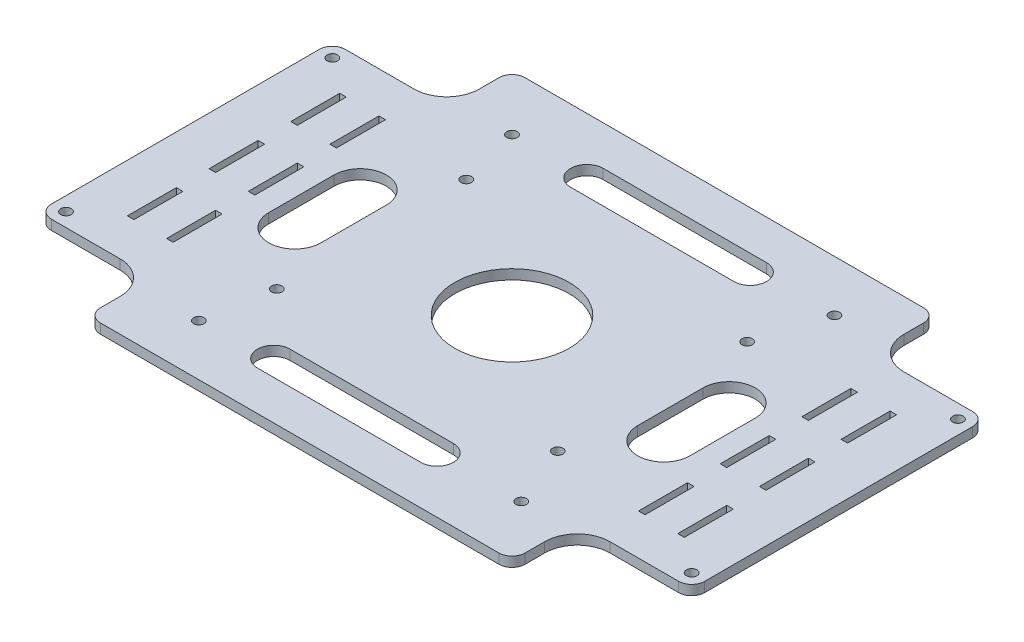
from build123d import *

# Parameters (mm, degrees)
SKETCH_1_R      = 1.6
SKETCH_1_R_2    = 17.5
SKETCH_1_W      = 2
SKETCH_1_H      = 15
EXTRUDE_1_DEPTH = 3
FILLET_2_R      = 4


with BuildPart() as part:
    # 草图1 → 凸台-拉伸1 (new body)
    with BuildSketch(Plane(origin=(0, 0, 0), x_dir=(1, 0, 0), z_dir=(0, 1, 0))):
        with BuildLine():
            Line((-65, 65), (65, 65))
            Line((65, 65), (65, 55))
            ThreePointArc((65, 55), (67.928932188, 47.928932188), (75, 45))
            Line((75, 45), (100, 45))
            Line((100, 45), (100, -45))
            Line((100, -45), (75, -45))
            ThreePointArc((75, -45), (67.928932188, -47.928932188), (65, -55))
            Line((65, -55), (65, -65))
            Line((65, -65), (-65, -65))
            Line((-65, -65), (-65, -55))
            ThreePointArc((-65, -55), (-67.928932188, -47.928932188), (-75, -45))
            Line((-75, -45), (-100, -45))
            Line((-100, -45), (-100, 45))
            Line((-100, 45), (-75, 45))
            ThreePointArc((-75, 45), (-67.928932188, 47.928932188), (-65, 55))
            Line((-65, 55), (-65, 65))
        make_face()
        with Locations(Location((-47.93, 47.93, 0), (0, 0, 270))):
            Circle(SKETCH_1_R, mode=Mode.SUBTRACT)
        with Locations(Location((49.344213562, 49.344213562, 0), (0, 0, 270))):
            Circle(SKETCH_1_R, mode=Mode.SUBTRACT)
        with Locations(Location((50.758427125, -47.93, 0), (0, 0, 270))):
            Circle(SKETCH_1_R, mode=Mode.SUBTRACT)
        with Locations(Location((-46.515786438, -49.344213562, 0), (0, 0, 270))):
            Circle(SKETCH_1_R, mode=Mode.SUBTRACT)
        with Locations(Location((43, -29, 0), (0, 0, 270))):
            Circle(SKETCH_1_R, mode=Mode.SUBTRACT)
        with Locations(Location((-43, -29, 0), (0, 0, 270))):
            Circle(SKETCH_1_R, mode=Mode.SUBTRACT)
        with Locations(Location((-43, 29, 0), (0, 0, 270))):
            Circle(SKETCH_1_R, mode=Mode.SUBTRACT)
        with Locations(Location((43, 29, 0), (0, 0, 270))):
            Circle(SKETCH_1_R, mode=Mode.SUBTRACT)
        with Locations(Location((0, 0, 0), (0, 0, 270))):
            Circle(SKETCH_1_R_2, mode=Mode.SUBTRACT)
        with Locations(Location((-95.757359313, 40.757359313, 0), (0, 0, 270))):
            Circle(SKETCH_1_R, mode=Mode.SUBTRACT)
        with Locations(Location((95.757359313, 40.757359313, 0), (0, 0, 270))):
            Circle(SKETCH_1_R, mode=Mode.SUBTRACT)
        with Locations(Location((95.757359313, -40.757359313, 0), (0, 0, 270))):
            Circle(SKETCH_1_R, mode=Mode.SUBTRACT)
        with Locations(Location((-95.757359313, -40.757359313, 0), (0, 0, 270))):
            Circle(SKETCH_1_R, mode=Mode.SUBTRACT)
        with Locations((-84.2325, 0)):
            Rectangle(SKETCH_1_W, SKETCH_1_H, mode=Mode.SUBTRACT)
        with BuildLine():
            Line((-48.465, 10), (-48.465, -10))
            ThreePointArc((-48.465, -10), (-56.465, -18), (-64.465, -10))
            Line((-64.465, -10), (-64.465, 10))
            ThreePointArc((-64.465, 10), (-56.465, 18), (-48.465, 10))
        make_face(mode=Mode.SUBTRACT)
        with BuildLine():
            Line((48.465, 10), (48.465, -10))
            ThreePointArc((48.465, -10), (56.465, -18), (64.465, -10))
            Line((64.465, -10), (64.465, 10))
            ThreePointArc((64.465, 10), (56.465, 18), (48.465, 10))
        make_face(mode=Mode.SUBTRACT)
        with BuildLine():
            Line((-25, 52.93), (25, 52.93))
            ThreePointArc((25, 52.93), (30, 47.93), (25, 42.93))
            Line((25, 42.93), (-25, 42.93))
            ThreePointArc((-25, 42.93), (-30, 47.93), (-25, 52.93))
        make_face(mode=Mode.SUBTRACT)
        with BuildLine():
            Line((-25, -52.93), (25, -52.93))
            ThreePointArc((25, -52.93), (30, -47.93), (25, -42.93))
            Line((25, -42.93), (-25, -42.93))
            ThreePointArc((-25, -42.93), (-30, -47.93), (-25, -52.93))
        make_face(mode=Mode.SUBTRACT)
        with Locations((-72.2325, 0)):
            Rectangle(SKETCH_1_W, SKETCH_1_H, mode=Mode.SUBTRACT)
        with Locations((-84.2325, -25)):
            Rectangle(SKETCH_1_W, SKETCH_1_H, mode=Mode.SUBTRACT)
        with Locations((-72.2325, -25)):
            Rectangle(SKETCH_1_W, SKETCH_1_H, mode=Mode.SUBTRACT)
        with Locations((-72.2325, 25)):
            Rectangle(SKETCH_1_W, SKETCH_1_H, mode=Mode.SUBTRACT)
        with Locations((-84.2325, 25)):
            Rectangle(SKETCH_1_W, SKETCH_1_H, mode=Mode.SUBTRACT)
        with Locations((84.2325, 25)):
            Rectangle(SKETCH_1_W, SKETCH_1_H, mode=Mode.SUBTRACT)
        with Locations((72.2325, 25)):
            Rectangle(SKETCH_1_W, SKETCH_1_H, mode=Mode.SUBTRACT)
        with Locations((84.2325, 0)):
            Rectangle(SKETCH_1_W, SKETCH_1_H, mode=Mode.SUBTRACT)
        with Locations((72.2325, 0)):
            Rectangle(SKETCH_1_W, SKETCH_1_H, mode=Mode.SUBTRACT)
        with Locations((84.2325, -25)):
            Rectangle(SKETCH_1_W, SKETCH_1_H, mode=Mode.SUBTRACT)
        with Locations((72.2325, -25)):
            Rectangle(SKETCH_1_W, SKETCH_1_H, mode=Mode.SUBTRACT)
    extrude(amount=EXTRUDE_1_DEPTH)

    # 圆角2
    fillet_2_edges = [part.edges().sort_by_distance(p)[0] for p in [
        (100, 1.5, -45),
        (100, 1.5, 45),
        (65, 1.5, 65),
        (-65, 1.5, 65),
        (-100, 1.5, 45),
        (-100, 1.5, -45),
        (-65, 1.5, -65),
        (65, 1.5, -65),
    ]]
    fillet(fillet_2_edges, radius=FILLET_2_R)


solid = part.part
